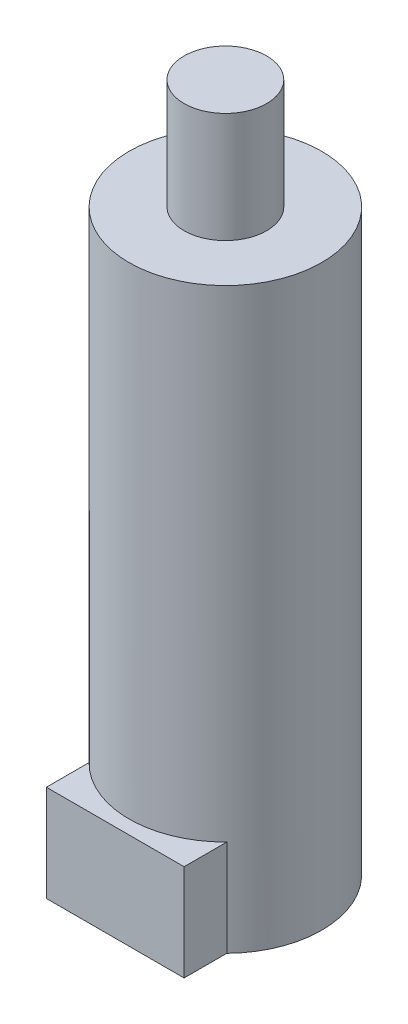
from build123d import *

# Parameters (mm, degrees)
SKETCH1_R           = 11.1125
BOSS_EXTRUDE1_DEPTH = 66.675
SKETCH2_W           = 15.875
SKETCH2_H           = 11.1125
BOSS_EXTRUDE2_DEPTH = 12.7
SKETCH3_R           = 4.7625
BOSS_EXTRUDE3_DEPTH = 12.7


with BuildPart() as part:
    # Sketch1 → Boss-Extrude1 (new body)
    with BuildSketch(Plane(origin=(0, 0, 0), x_dir=(1, 0, 0), z_dir=(0, 1, 0))):
        Circle(SKETCH1_R)
    extrude(amount=BOSS_EXTRUDE1_DEPTH)

    # Sketch2 → Boss-Extrude2 (add)
    with BuildSketch(Plane.XY):
        with Locations((0, 5.55625)):
            Rectangle(SKETCH2_W, SKETCH2_H)
    extrude(amount=BOSS_EXTRUDE2_DEPTH)

    # Sketch3 → Boss-Extrude3 (add)
    with BuildSketch(Plane(origin=(0, 66.675, 0), x_dir=(1, 0, 0), z_dir=(0, 1, 0))):
        Circle(SKETCH3_R)
    extrude(amount=BOSS_EXTRUDE3_DEPTH)


solid = part.part
